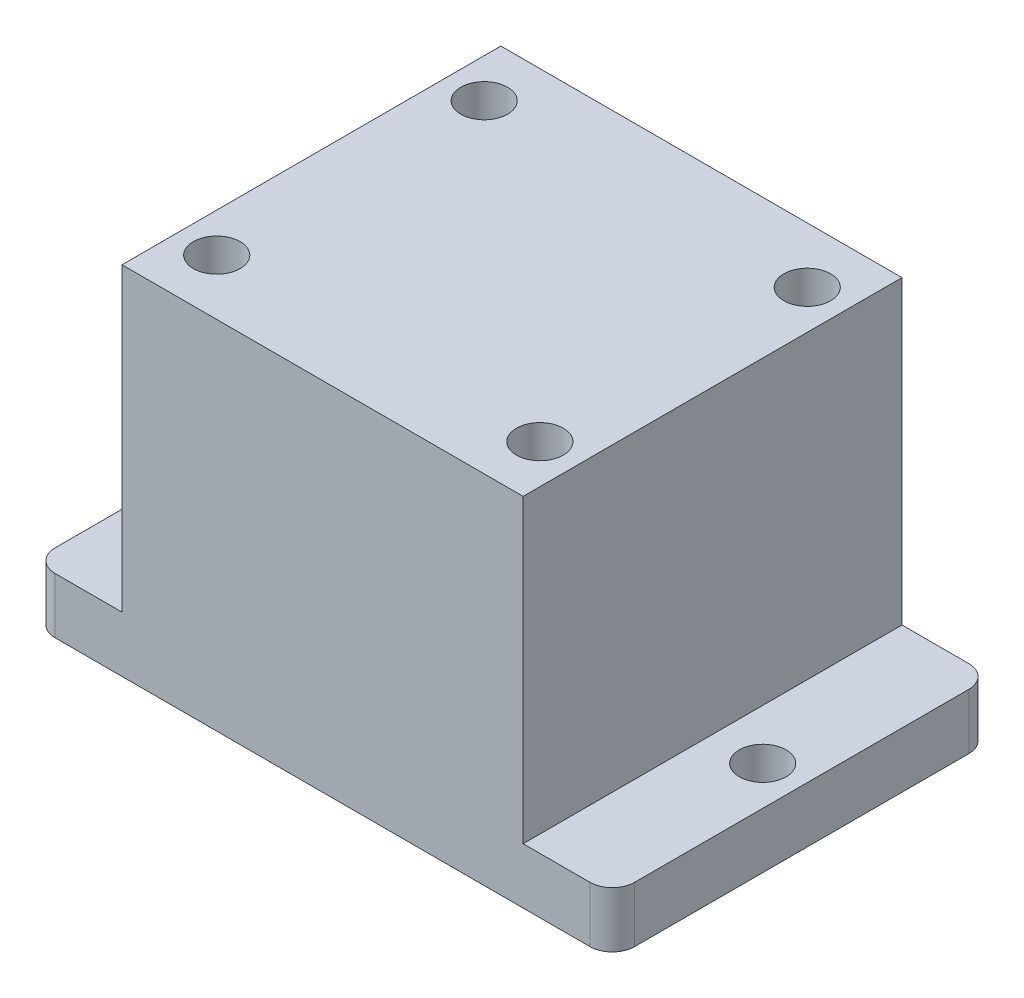
from build123d import *

# Parameters (mm, degrees)
SKETCH_1_W          = 52
SKETCH_1_H          = 34
SKETCH_1_R          = 2.1
EXTRUDE_1_DEPTH     = 5
SKETCH_2_W          = 36
SKETCH_2_H          = 34
EXTRUDE_2_DEPTH     = 27
SKETCH_3_R          = 2.1
CUT_EXTRUDE_1_DEPTH = 10
FILLET_1_R          = 2
FILLET_2_R          = 2
FILLET_3_R          = 2
FILLET_4_R          = 2


with BuildPart() as part:
    # 草图1 → 凸台-拉伸1 (new body)
    with BuildSketch(Plane(origin=(0, 0, 0), x_dir=(1, 0, 0), z_dir=(0, 1, 0))):
        with Locations((1, 0)):
            Rectangle(SKETCH_1_W, SKETCH_1_H)
        with Locations(Location((-21.5, 0, 0), (0, 0, 270))):
            Circle(SKETCH_1_R, mode=Mode.SUBTRACT)
        with Locations(Location((23.5, 0, 0), (0, 0, 90))):
            Circle(SKETCH_1_R, mode=Mode.SUBTRACT)
    extrude(amount=EXTRUDE_1_DEPTH)

    # 草图2 → 凸台-拉伸2 (add)
    with BuildSketch(Plane(origin=(0, 5, 0), x_dir=(1, 0, 0), z_dir=(0, 1, 0))):
        with Locations((1, 0)):
            Rectangle(SKETCH_2_W, SKETCH_2_H)
    extrude(amount=EXTRUDE_2_DEPTH)

    # 草图3 → 切除-拉伸1 (cut)
    with BuildSketch(Plane(origin=(0, 32, 0), x_dir=(1, 0, 0), z_dir=(0, 1, 0))):
        with Locations(Location((-13.5, 12, 0), (0, 0, 270))):
            Circle(SKETCH_3_R)
        with Locations(Location((15.5, 12, 0), (0, 0, 270))):
            Circle(SKETCH_3_R)
        with Locations(Location((15.5, -12, 0), (0, 0, 270))):
            Circle(SKETCH_3_R)
        with Locations(Location((-13.5, -12, 0), (0, 0, 270))):
            Circle(SKETCH_3_R)
    extrude(amount=-CUT_EXTRUDE_1_DEPTH, mode=Mode.SUBTRACT)

    # 圆角1
    fillet_1_edges = [part.edges().sort_by_distance(p)[0] for p in [
        (-25, 2.5, -17),
    ]]
    fillet(fillet_1_edges, radius=FILLET_1_R)

    # 圆角2
    fillet_2_edges = [part.edges().sort_by_distance(p)[0] for p in [
        (-25, 2.5, 17),
    ]]
    fillet(fillet_2_edges, radius=FILLET_2_R)

    # 圆角3
    fillet_3_edges = [part.edges().sort_by_distance(p)[0] for p in [
        (27, 2.5, 17),
    ]]
    fillet(fillet_3_edges, radius=FILLET_3_R)

    # 圆角4
    fillet_4_edges = [part.edges().sort_by_distance(p)[0] for p in [
        (27, 2.5, -17),
    ]]
    fillet(fillet_4_edges, radius=FILLET_4_R)


solid = part.part
